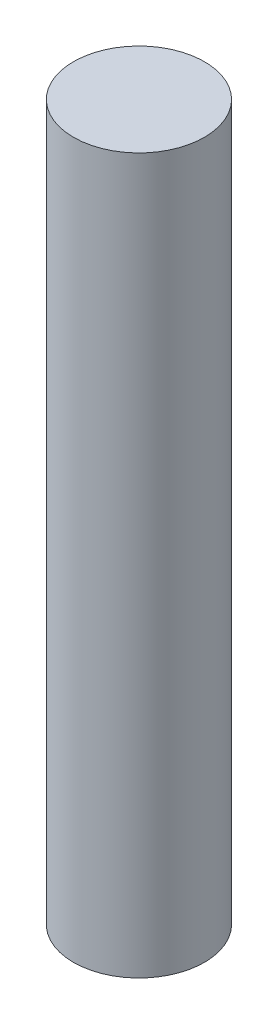
from build123d import *

# Parameters (mm, degrees)
SKETCH1_R           = 5.5
BOSS_EXTRUDE1_DEPTH = 60


with BuildPart() as part:
    # Sketch1 → Boss-Extrude1 (new body)
    with BuildSketch(Plane(origin=(0, 0, 0), x_dir=(1, 0, 0), z_dir=(0, 1, 0))):
        with Locations(Location((0, 0, 0), (0, 0, 270))):
            Circle(SKETCH1_R)
    extrude(amount=BOSS_EXTRUDE1_DEPTH)


solid = part.part
